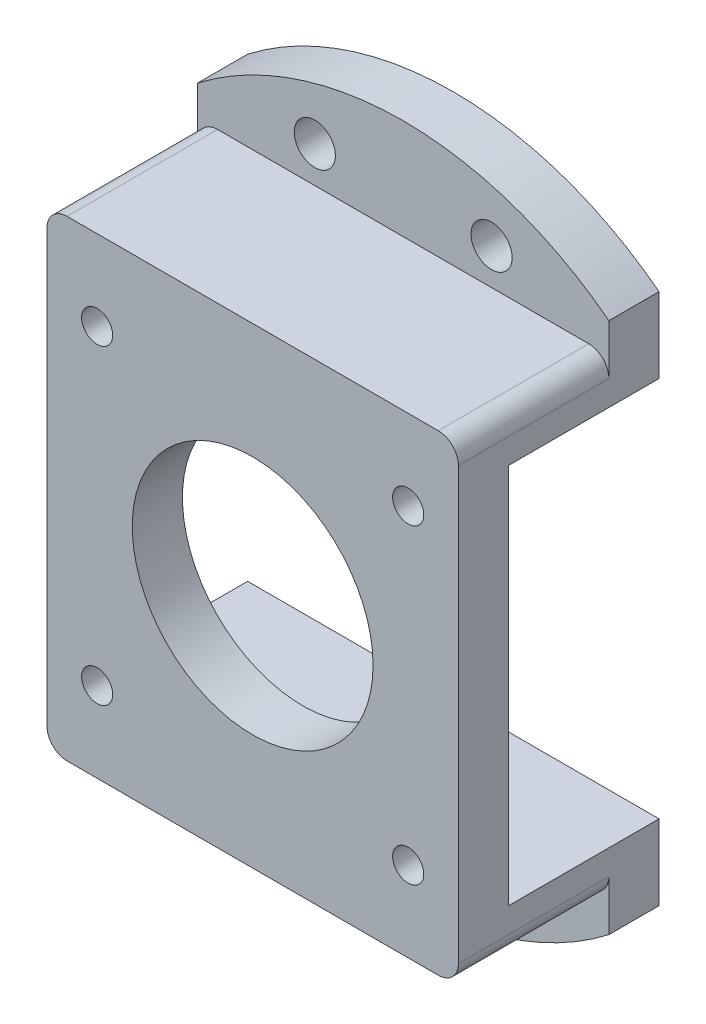
from build123d import *

# Parameters (mm, degrees)
SKETCH1_W           = 41
SKETCH1_H           = 38
SKETCH1_R           = 1.55
SKETCH1_R_2         = 12
BOSS_EXTRUDE1_DEPTH = 5
SKETCH2_W           = 41
SKETCH2_H           = 4.5
BOSS_EXTRUDE2_DEPTH = 20
SKETCH3_R           = 2.05
BOSS_EXTRUDE3_DEPTH = 5
FILLET1_R           = 2


with BuildPart() as part:
    # Sketch1 → Boss-Extrude1 (new body)
    with BuildSketch(Plane.XY):
        Rectangle(SKETCH1_W, SKETCH1_H)
        with Locations((15.5, 15.5)):
            Circle(SKETCH1_R, mode=Mode.SUBTRACT)
        with Locations((-15.5, 15.5)):
            Circle(SKETCH1_R, mode=Mode.SUBTRACT)
        with Locations((15.5, -15.5)):
            Circle(SKETCH1_R, mode=Mode.SUBTRACT)
        with Locations((-15.5, -15.5)):
            Circle(SKETCH1_R, mode=Mode.SUBTRACT)
        Circle(SKETCH1_R_2, mode=Mode.SUBTRACT)
    extrude(amount=BOSS_EXTRUDE1_DEPTH)

    # Sketch2 → Boss-Extrude2 (add)
    with BuildSketch(Plane.XY.offset(5)):
        with Locations((0, 21.25)):
            Rectangle(SKETCH2_W, SKETCH2_H)
        with Locations((0, -21.25)):
            Rectangle(SKETCH2_W, SKETCH2_H)
    extrude(amount=-BOSS_EXTRUDE2_DEPTH)

    # Sketch3 → Boss-Extrude3 (add)
    # profile 1 of 2: a face of its own
    with BuildSketch(Plane(origin=(0, 0, -15), x_dir=(-1, 0, 0), z_dir=(0, 0, -1))):
        with BuildLine():
            Line((-20.5, 26.495282599), (-20.5, 23.5))
            Line((-20.5, 23.5), (20.5, 23.5))
            Line((20.5, 23.5), (20.5, 26.495282599))
            ThreePointArc((20.5, 26.495282599), (10.831851903, 31.700488708), (-7.9e-08, 33.5))
            ThreePointArc((-7.9e-08, 33.5), (-10.831851978, 31.700488683), (-20.5, 26.495282599))
        make_face()
        with Locations((-8.80698434, 27.105110714)):
            Circle(SKETCH3_R, mode=Mode.SUBTRACT)
        with Locations((8.80698434, 27.105110714)):
            Circle(SKETCH3_R, mode=Mode.SUBTRACT)
    # profile 2 of 2: a face of its own
    with BuildSketch(Plane(origin=(0, 0, -15), x_dir=(-1, 0, 0), z_dir=(0, 0, -1))):
        with BuildLine():
            Line((-20.5, -23.5), (-20.5, -26.495282599))
            ThreePointArc((-20.5, -26.495282599), (-10.831851978, -31.700488683), (-7.9e-08, -33.5))
            ThreePointArc((-7.9e-08, -33.5), (10.831851903, -31.700488708), (20.5, -26.495282599))
            Line((20.5, -26.495282599), (20.5, -23.5))
            Line((20.5, -23.5), (-20.5, -23.5))
        make_face()
        with Locations((-8.80698434, -27.105110714)):
            Circle(SKETCH3_R, mode=Mode.SUBTRACT)
        with Locations((8.80698434, -27.105110714)):
            Circle(SKETCH3_R, mode=Mode.SUBTRACT)
    extrude(amount=-BOSS_EXTRUDE3_DEPTH)

    # Fillet1
    fillet1_edges = [part.edges().sort_by_distance(p)[0] for p in [
        (20.5, 23.5, -2.5),
        (-20.5, 23.5, -2.5),
        (-20.5, -23.5, -2.5),
        (20.5, -23.5, -2.5),
    ]]
    fillet(fillet1_edges, radius=FILLET1_R)


solid = part.part
